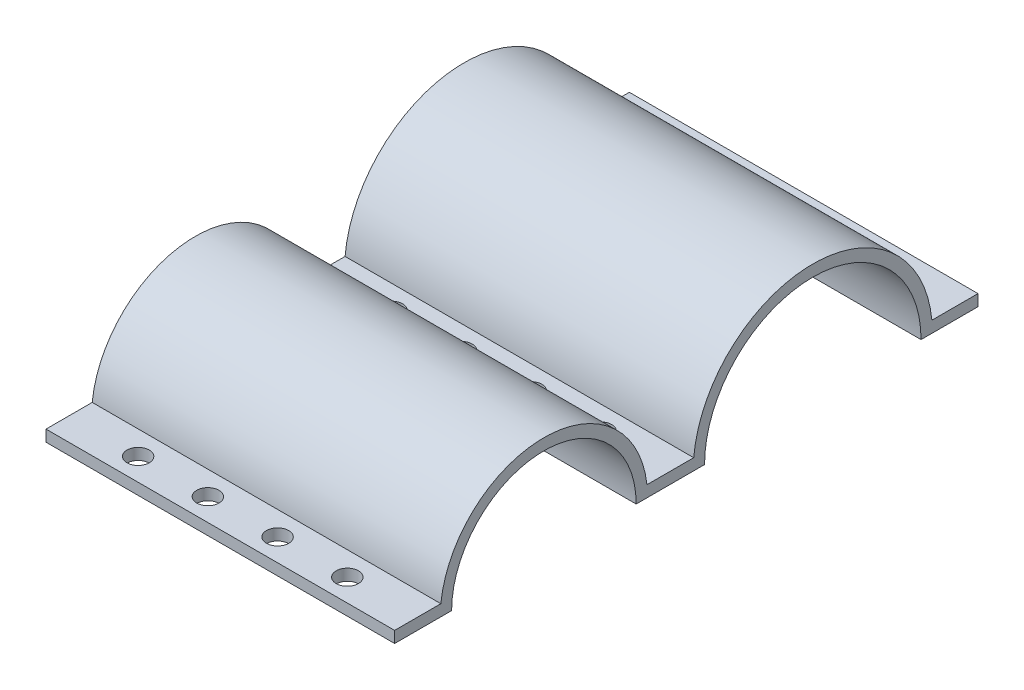
from build123d import *

# Parameters (mm, degrees)
BOSS_EXTRUDE1_DEPTH = 61.2
SKETCH3_R           = 1.95
CUT_EXTRUDE1_DEPTH  = 2


with BuildPart() as part:
    # Sketch2 → Boss-Extrude1 (new body)
    with BuildSketch(Plane(origin=(0, 0, 0), x_dir=(0, 0, -1), z_dir=(1, 0, 0))):
        with BuildLine():
            Line((0, 0), (-10, 0))
            ThreePointArc((-10, 0), (-29, 19), (-48, 0))
            Line((-48, 0), (-60, 0))
            ThreePointArc((-60, 0), (-76.2, 16.2), (-92.4, 0))
            Line((-92.4, 0), (-102.4, 0))
            Line((-102.4, 0), (-102.4, 2))
            Line((-102.4, 2), (-94.289776118, 2))
            ThreePointArc((-94.289776118, 2), (-76.2, 18.2), (-58.110223882, 2))
            Line((-58.110223882, 2), (-49.90454496, 2))
            ThreePointArc((-49.90454496, 2), (-29, 21), (-8.09545504, 2))
            Line((-8.09545504, 2), (0, 2))
            Line((0, 2), (0, 0))
        make_face()
    extrude(amount=BOSS_EXTRUDE1_DEPTH)

    # Sketch3 → Cut-Extrude1 (cut)
    with BuildSketch(Plane(origin=(0, 2, 0), x_dir=(1, 0, 0), z_dir=(0, 1, 0))):
        with Locations(Location((12.24, -3.93, 0), (0, 0, 270))):
            Circle(SKETCH3_R)
        with Locations(Location((24.48, -3.93, 0), (0, 0, 270))):
            Circle(SKETCH3_R)
        with Locations(Location((36.72, -3.93, 0), (0, 0, 270))):
            Circle(SKETCH3_R)
        with Locations(Location((48.96, -3.93, 0), (0, 0, 270))):
            Circle(SKETCH3_R)
        with Locations(Location((12.24, -54.007384421, 0), (0, 0, 270))):
            Circle(SKETCH3_R)
        with Locations(Location((24.48, -54.007384421, 0), (0, 0, 270))):
            Circle(SKETCH3_R)
        with Locations(Location((36.72, -54.007384421, 0), (0, 0, 270))):
            Circle(SKETCH3_R)
        with Locations(Location((48.96, -54.007384421, 0), (0, 0, 270))):
            Circle(SKETCH3_R)
        with Locations(Location((12.24, -98.47, 0), (0, 0, 270))):
            Circle(SKETCH3_R)
        with Locations(Location((24.48, -98.47, 0), (0, 0, 270))):
            Circle(SKETCH3_R)
        with Locations(Location((36.72, -98.47, 0), (0, 0, 270))):
            Circle(SKETCH3_R)
        with Locations(Location((48.96, -98.47, 0), (0, 0, 270))):
            Circle(SKETCH3_R)
    extrude(amount=-CUT_EXTRUDE1_DEPTH, mode=Mode.SUBTRACT)


solid = part.part
